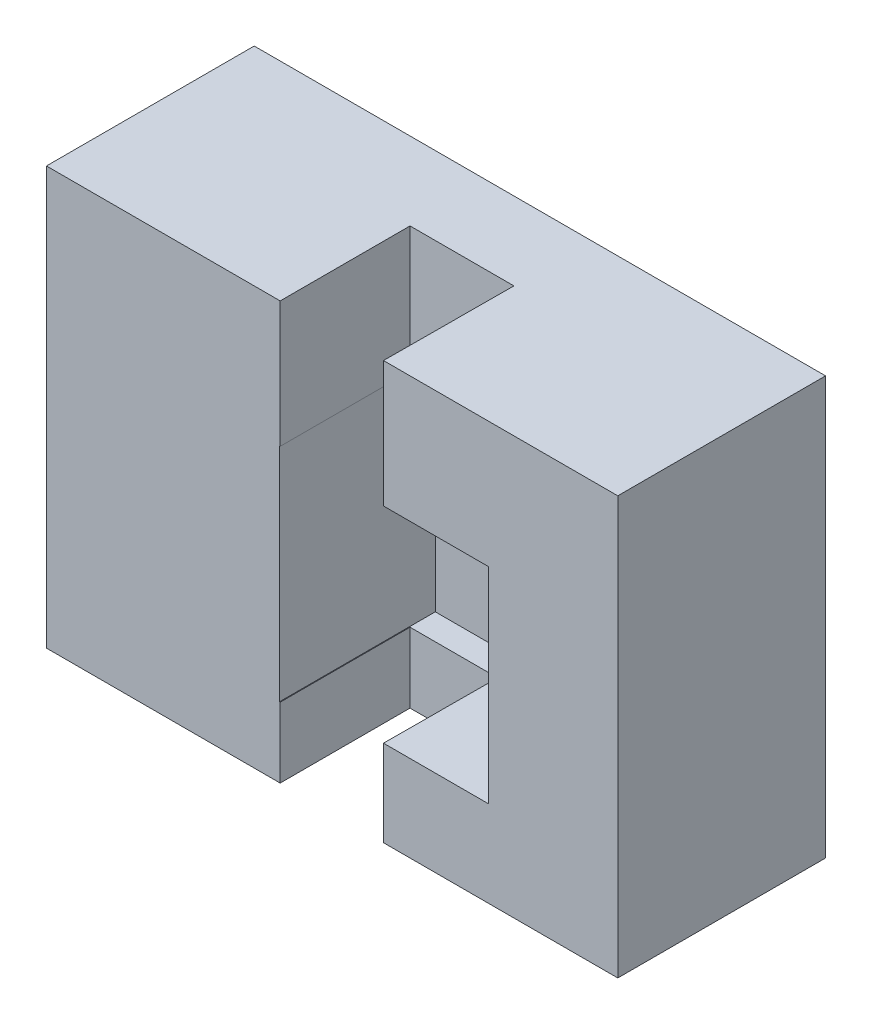
from build123d import *

# Parameters (mm, degrees)
IZIM1_W                     = 110
IZIM1_H                     = 80.4
Y_KSEKLIK_EKSTR_ZYON1_DEPTH = 40
KES_EKSTR_ZYON1_DEPTH       = 30
KES_EKSTR_ZYON2_DEPTH       = 106.305080599


with BuildPart() as part:
    # Çizim1 → Yükseklik-Ekstrüzyon1 (new body)
    with BuildSketch(Plane.XY):
        Rectangle(IZIM1_W, IZIM1_H)
    extrude(amount=Y_KSEKLIK_EKSTR_ZYON1_DEPTH)

    # Çizim2 → Kes-Ekstrüzyon1 (cut)
    with BuildSketch(Plane.XY.offset(40)):
        Polygon((30.097607873, 15.947775896), (-10.133916247, 15.947775896), (-10.133916247, -26.710477825), (9.889023344, -26.710477825), (9.889023344, -23.599429186), (30.097607873, -23.599429186), align=None)
    extrude(amount=-KES_EKSTR_ZYON1_DEPTH, mode=Mode.SUBTRACT)

    # Çizim3 → Kes-Ekstrüzyon2 (cut, through all)
    with BuildSketch(Plane(origin=(0, 40.2, 0), x_dir=(1, 0, 0), z_dir=(0, 1, 0))):
        Polygon((9.889023344, -40), (10, -15), (-10, -15), (-10, -40), align=None)
    extrude(amount=-KES_EKSTR_ZYON2_DEPTH, mode=Mode.SUBTRACT)


solid = part.part
